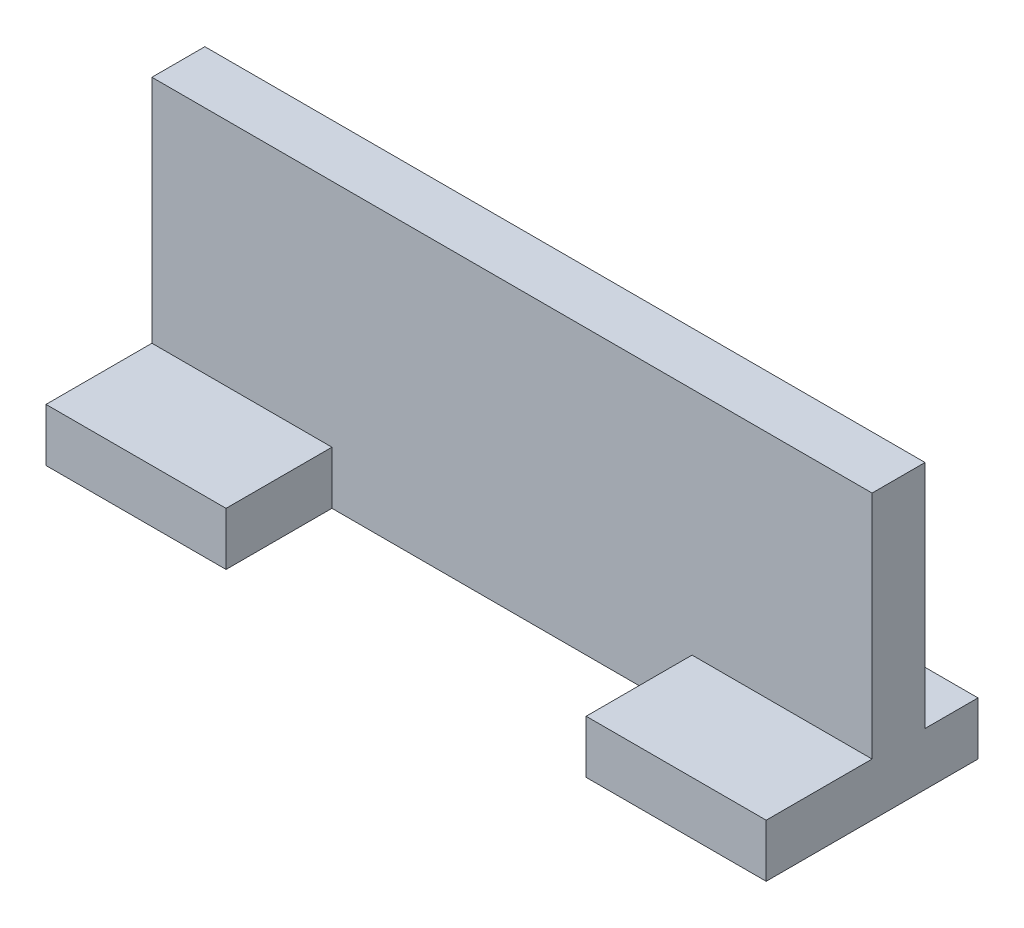
from build123d import *

# Parameters (mm, degrees)
SKETCH1_W           = 136
SKETCH1_H           = 53.5
BOSS_EXTRUDE1_DEPTH = 10
SKETCH2_R           = 5
BOSS_EXTRUDE2_DEPTH = 12
SKETCH3_W           = 10
SKETCH3_H           = 10
SKETCH3_W_2         = 20
BOSS_EXTRUDE3_DEPTH = 34


with BuildPart() as part:
    # Sketch1 → Boss-Extrude1 (new body)
    with BuildSketch(Plane.XY):
        Rectangle(SKETCH1_W, SKETCH1_H)
    extrude(amount=BOSS_EXTRUDE1_DEPTH)

    # Sketch2 → Boss-Extrude2 (add)
    with BuildSketch(Plane(origin=(0, 0, 0), x_dir=(-1, 0, 0), z_dir=(0, 0, -1))):
        with Locations(Location((12.5, 9.25, 0), (0, 0, 180))):
            Circle(SKETCH2_R)
        with Locations(Location((-12.5, 9.25, 0), (0, 0, 180))):
            Circle(SKETCH2_R)
    extrude(amount=BOSS_EXTRUDE2_DEPTH)

    # Sketch3 → Boss-Extrude3 (add)
    with BuildSketch(Plane.ZY.offset(68)):
        with Locations((-5, -21.75)):
            Rectangle(SKETCH3_W, SKETCH3_H)
        with Locations((20, -21.75)):
            Rectangle(SKETCH3_W_2, SKETCH3_H)
    boss_extrude3 = extrude(amount=-BOSS_EXTRUDE3_DEPTH)

    # Mirror2: Boss-Extrude3 across plane
    add(boss_extrude3.mirror(Plane.ZY))


solid = part.part
